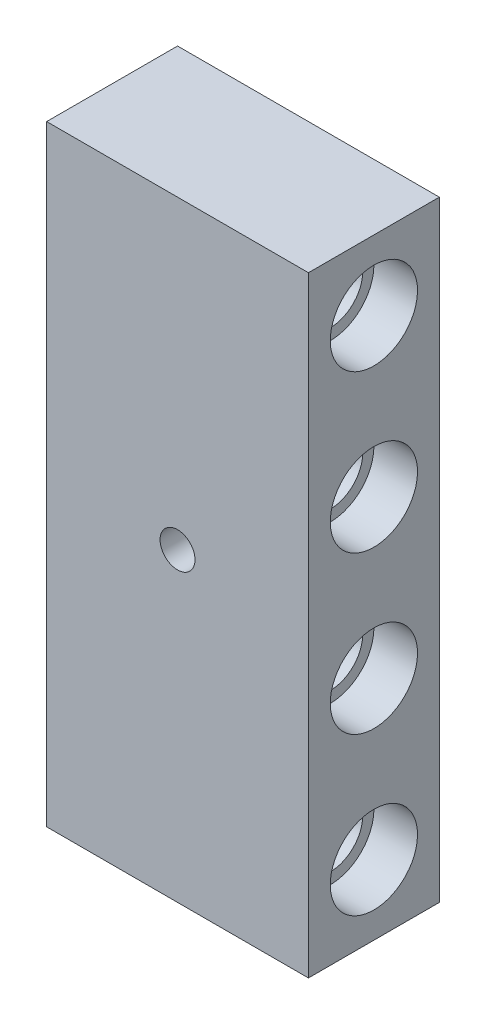
from build123d import *

# Parameters (mm, degrees)
SKETCH1_W           = 19.05
SKETCH1_H           = 44.45
SKETCH1_R           = 1.27
BOSS_EXTRUDE1_DEPTH = 9.525
SKETCH2_R           = 2.3622
CUT_EXTRUDE1_DEPTH  = 50.289254661
SKETCH5_R           = 3.175
SKETCH5_R_2         = 2.3622
CUT_EXTRUDE2_DEPTH  = 3.175


with BuildPart() as part:
    # Sketch1 → Boss-Extrude1 (new body)
    with BuildSketch(Plane.XY):
        with Locations((9.525, 22.225)):
            Rectangle(SKETCH1_W, SKETCH1_H)
        with Locations(Location((9.525, 22.225, 0), (0, 0, 180))):
            Circle(SKETCH1_R, mode=Mode.SUBTRACT)
    extrude(amount=BOSS_EXTRUDE1_DEPTH)

    # Sketch2 → Cut-Extrude1 (cut, through all)
    with BuildSketch(Plane(origin=(19.05, 0, 0), x_dir=(0, 0, -1), z_dir=(1, 0, 0))):
        with Locations((-4.7625, 16.51)):
            Circle(SKETCH2_R)
        with Locations((-4.7625, 39.37)):
            Circle(SKETCH2_R)
        with Locations((-4.7625, 27.94)):
            Circle(SKETCH2_R)
        with Locations((-4.7625, 5.08)):
            Circle(SKETCH2_R)
    extrude(amount=-CUT_EXTRUDE1_DEPTH, mode=Mode.SUBTRACT)

    # Sketch5 → Cut-Extrude2 (cut)
    # profile 1 of 4: a face of its own
    with BuildSketch(Plane(origin=(19.05, 0, 0), x_dir=(0, 0, -1), z_dir=(1, 0, 0))):
        with Locations(Location((-4.7625, 5.08, 0), (0, 0, 90))):
            Circle(SKETCH5_R)
        with Locations((-4.7625, 5.08)):
            Circle(SKETCH5_R_2, mode=Mode.SUBTRACT)
    # profile 2 of 4: a face of its own
    with BuildSketch(Plane(origin=(19.05, 0, 0), x_dir=(0, 0, -1), z_dir=(1, 0, 0))):
        with Locations(Location((-4.7625, 16.51, 0), (0, 0, 90))):
            Circle(SKETCH5_R)
        with Locations((-4.7625, 16.51)):
            Circle(SKETCH5_R_2, mode=Mode.SUBTRACT)
    # profile 3 of 4: a face of its own
    with BuildSketch(Plane(origin=(19.05, 0, 0), x_dir=(0, 0, -1), z_dir=(1, 0, 0))):
        with Locations(Location((-4.7625, 27.94, 0), (0, 0, 90))):
            Circle(SKETCH5_R)
        with Locations((-4.7625, 27.94)):
            Circle(SKETCH5_R_2, mode=Mode.SUBTRACT)
    # profile 4 of 4: a face of its own
    with BuildSketch(Plane(origin=(19.05, 0, 0), x_dir=(0, 0, -1), z_dir=(1, 0, 0))):
        with Locations(Location((-4.7625, 39.37, 0), (0, 0, 90))):
            Circle(SKETCH5_R)
        with Locations((-4.7625, 39.37)):
            Circle(SKETCH5_R_2, mode=Mode.SUBTRACT)
    cut_extrude2 = extrude(amount=-CUT_EXTRUDE2_DEPTH, mode=Mode.SUBTRACT)

    # Mirror1: Cut-Extrude2 across plane
    add(cut_extrude2.mirror(Plane(origin=(9.525, 0, 0), x_dir=(0, 0, 1), z_dir=(1, 0, 0))), mode=Mode.SUBTRACT)


solid = part.part
